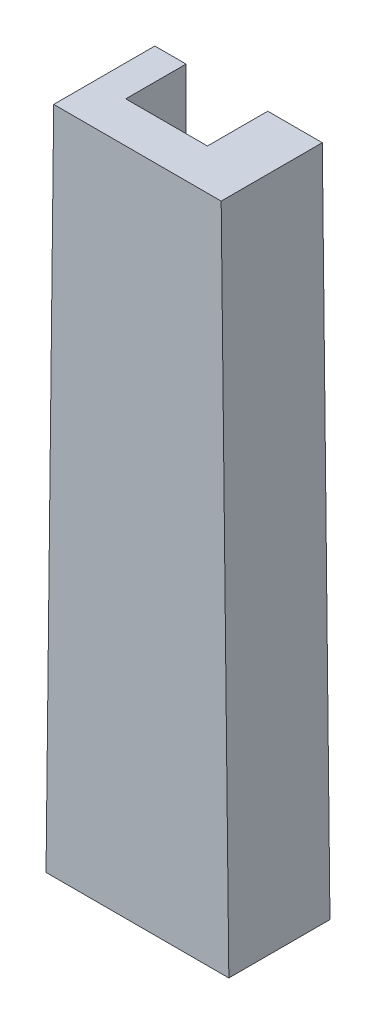
from build123d import *

# Parameters (mm, degrees)
SKETCH3_W          = 10.5
SKETCH3_H          = 7.752761779
CUT_EXTRUDE1_DEPTH = 83


with BuildPart() as part:
    # Sketch1 → Loft1 section 0
    with BuildSketch(Plane(origin=(0, 0, 0), x_dir=(1, 0, 0), z_dir=(0, 1, 0))):
        with BuildLine():
            Line((-11.888349515, -12.616504854), (11.611650485, -12.616504854))
            Line((11.611650485, -12.616504854), (11.611650485, 0.383495146))
            Line((11.611650485, 0.383495146), (-11.888349515, 0.383495146))
            Line((-11.888349515, 0.383495146), (-11.888349515, -12.616504854))
        make_face()
    # Sketch2 → Loft1 section 1
    with BuildSketch(Plane(origin=(0, 86, 0), x_dir=(1, 0, 0), z_dir=(0, 1, 0))):
        with BuildLine():
            Line((-10.903349515, -12.616504854), (-10.903349515, 0.383495146))
            Line((-10.903349515, 0.383495146), (10.626650485, 0.383495146))
            Line((10.626650485, 0.383495146), (10.626650485, -12.616504854))
            Line((10.626650485, -12.616504854), (-10.903349515, -12.616504854))
        make_face()
    loft()

    # Sketch3 → Cut-Extrude1 (cut)
    with BuildSketch(Plane(origin=(0, 86, 0), x_dir=(1, 0, 0), z_dir=(0, 1, 0))):
        with Locations((-1.638349515, -3.492885744)):
            Rectangle(SKETCH3_W, SKETCH3_H)
    extrude(amount=-CUT_EXTRUDE1_DEPTH, mode=Mode.SUBTRACT)


solid = part.part
